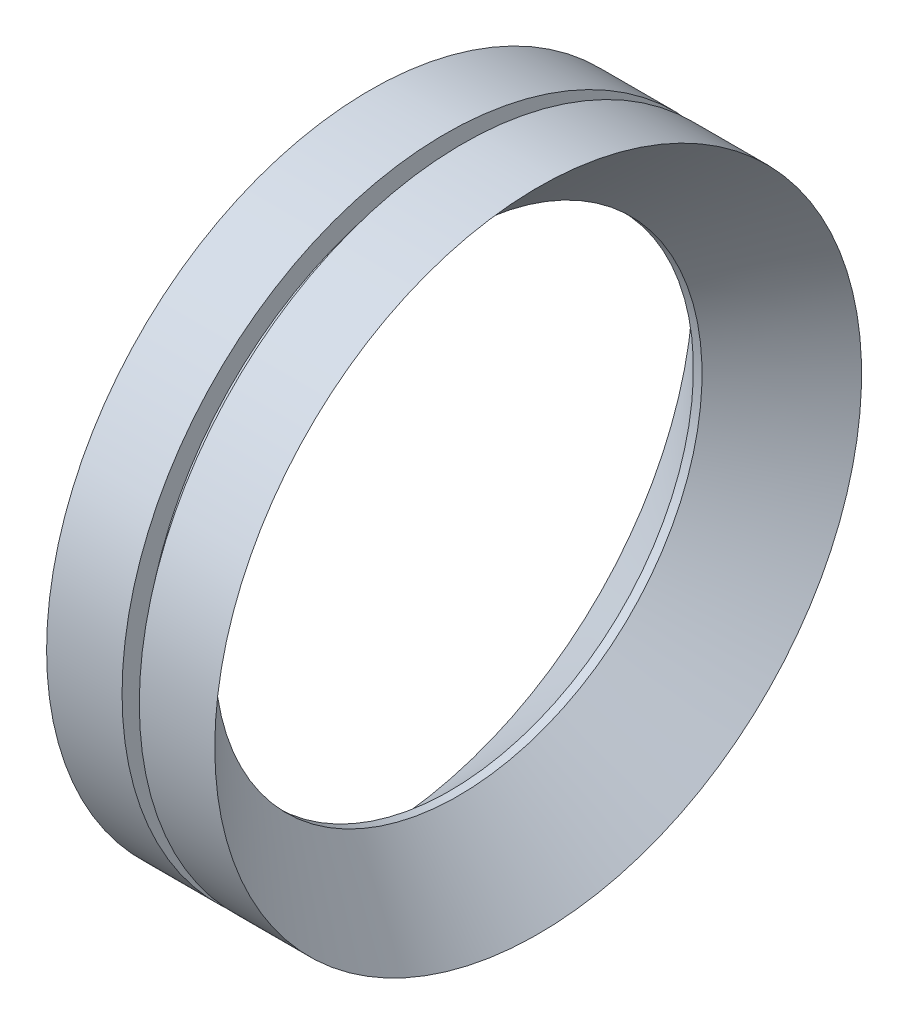
from build123d import *


with BuildPart() as part:
    # Эскиз1 → Повернуть1 (revolve)
    with BuildSketch(Plane.XY, mode=Mode.PRIVATE) as revolve_1_sk:
        Polygon((-43, -150), (-8, -150), (-8, -140), (0, -140), (0, -150), (35, -150), (-2, -113), (-6, -113), align=None)
    revolve(revolve_1_sk.sketch.rotate(Axis((-128.467741935, 0, 0), (1, 0, 0)), 270), axis=Axis((-128.467741935, 0, 0), (1, 0, 0)))


solid = part.part
